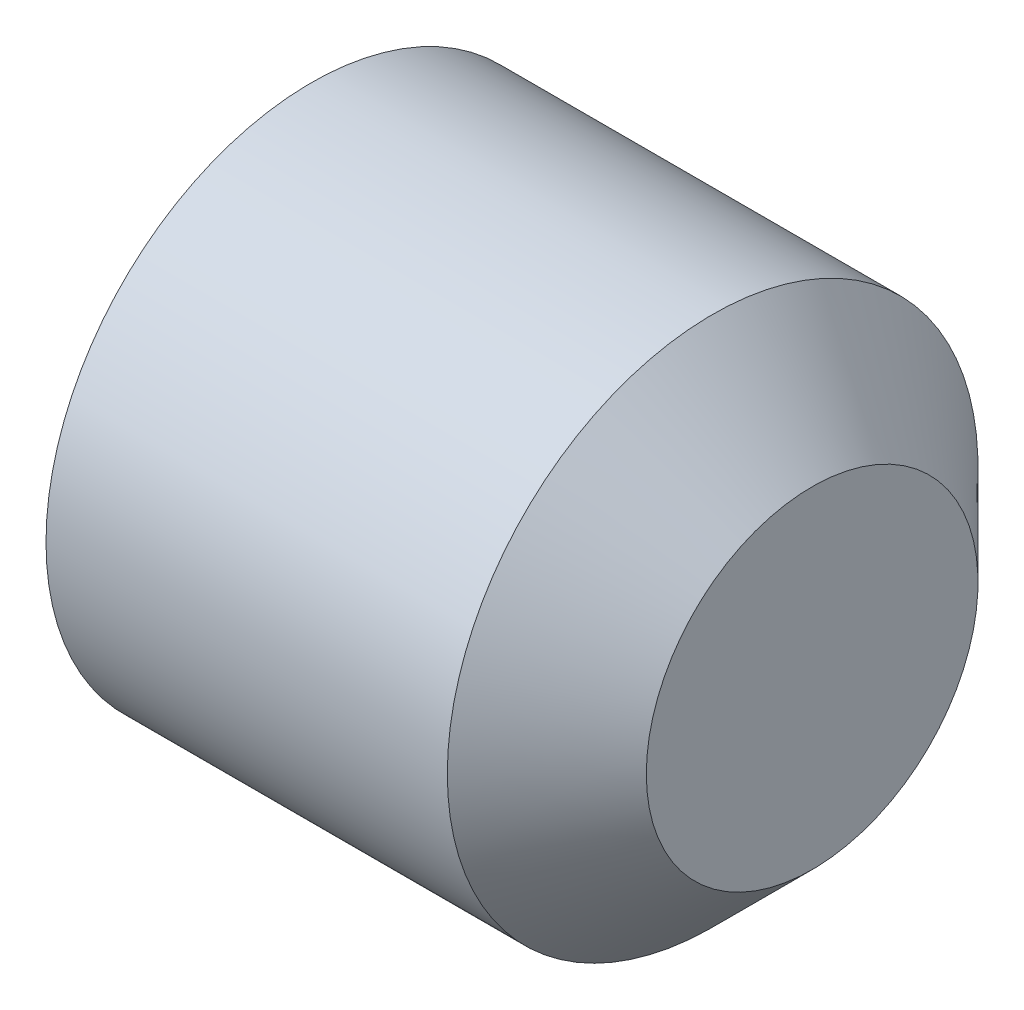
from build123d import *

# Parameters (mm, degrees)
HEX_2_DEPTH = 1.8


with BuildPart() as part:
    # BodySke → BaseBody (revolve)
    with BuildSketch(Plane.XY, mode=Mode.PRIVATE) as basebody_sk:
        Polygon((0, 0), (0, 1.61), (0.225166605, 2), (3.25, 2), (4, 1.25), (4, 0), align=None)
    revolve(basebody_sk.sketch.rotate(Axis((-12.7, 0, 0), (1, 0, 0)), 90), axis=Axis((-12.7, 0, 0), (1, 0, 0)))

    # Sketch2 → Hex 2 (cut)
    with BuildSketch(Plane.ZY):
        Polygon((0.577350269, 1), (-0.577350269, 1), (-1.154700538, 0), (-0.577350269, -1), (0.577350269, -1), (1.154700538, 0), align=None)
    extrude(amount=-HEX_2_DEPTH, mode=Mode.SUBTRACT)


solid = part.part
